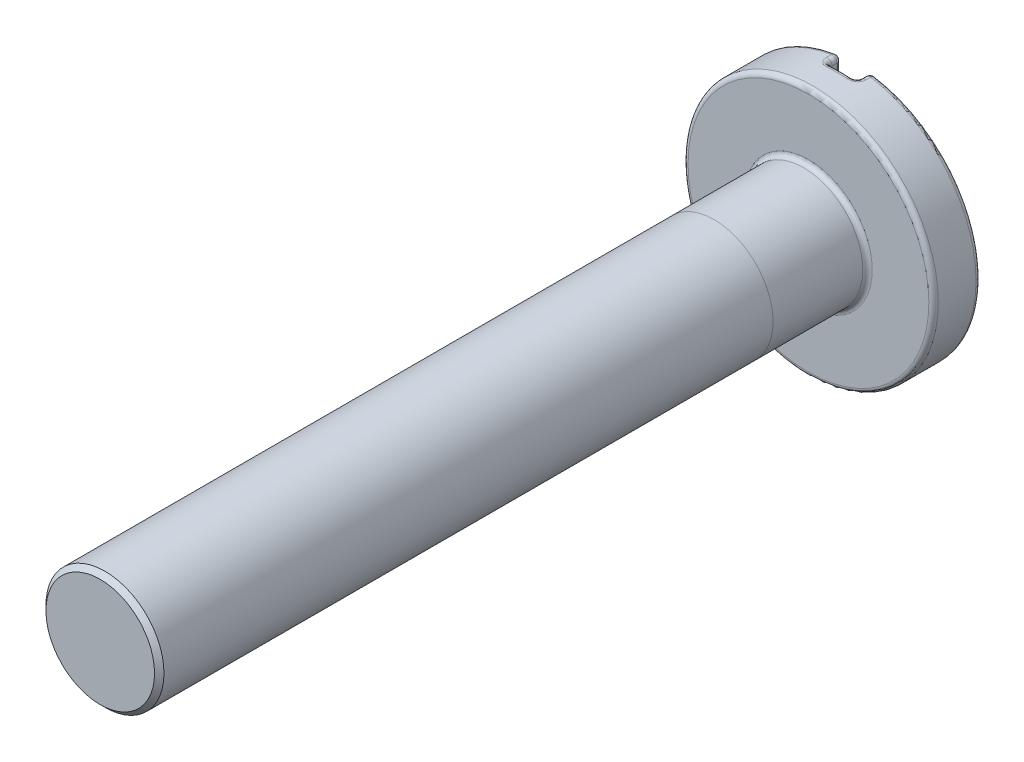
from build123d import *

# Parameters (mm, degrees)
SKETCH1_R           = 0.625
BOSS_EXTRUDE1_DEPTH = 7.5
SKETCH2_R           = 1.325
BOSS_EXTRUDE2_DEPTH = 0.5
SKETCH3_W           = 0.3
SKETCH3_H           = 8.393754192
CUT_EXTRUDE1_DEPTH  = 0.15
FILLET1_R           = 0.05
FILLET2_R           = 0.05
CHAMFER1_SIZE       = 0.05


with BuildPart() as part:
    # Sketch1 → Boss-Extrude1 (new body)
    with BuildSketch(Plane.XY):
        Circle(SKETCH1_R)
    extrude(amount=BOSS_EXTRUDE1_DEPTH)

    # Sketch2 → Boss-Extrude2 (add)
    with BuildSketch(Plane.XY):
        Circle(SKETCH2_R)
    extrude(amount=-BOSS_EXTRUDE2_DEPTH)

    # Sketch3 → Cut-Extrude1 (cut)
    with BuildSketch(Plane(origin=(0, 0, -0.5), x_dir=(-1, 0, 0), z_dir=(0, 0, -1))):
        Rectangle(SKETCH3_W, SKETCH3_H)
    extrude(amount=-CUT_EXTRUDE1_DEPTH, mode=Mode.SUBTRACT)

    # Fillet1
    fillet1_edges = [part.edges().sort_by_distance(p)[0] for p in [
        (-1.325, 0, -0.5),
        (0.988527946, 0.882291052, -0.5),
        (0.15, 0, -0.5),
        (-0.15, 0, -0.5),
        (0, 1.325, -0.35),
        (0, -1.325, -0.35),
        (-0.15, -1.316482055, -0.425),
        (-0.15, 1.316482055, -0.425),
        (0.15, 1.316482055, -0.425),
        (0.15, -1.316482055, -0.425),
        (-0.15, 0, -0.35),
        (0.15, 0, -0.35),
        (-0.625, 0, 0),
    ]]
    fillet(fillet1_edges, radius=FILLET1_R)

    # Fillet2
    fillet2_edges = [part.edges().sort_by_distance(p)[0] for p in [
        (-1.325, 0, 0),
    ]]
    fillet(fillet2_edges, radius=FILLET2_R)

    # Chamfer1
    chamfer1_edges = [part.edges().sort_by_distance(p)[0] for p in [
        (-0.625, 0, 7.5),
    ]]
    chamfer(chamfer1_edges, length=CHAMFER1_SIZE)


solid = part.part
